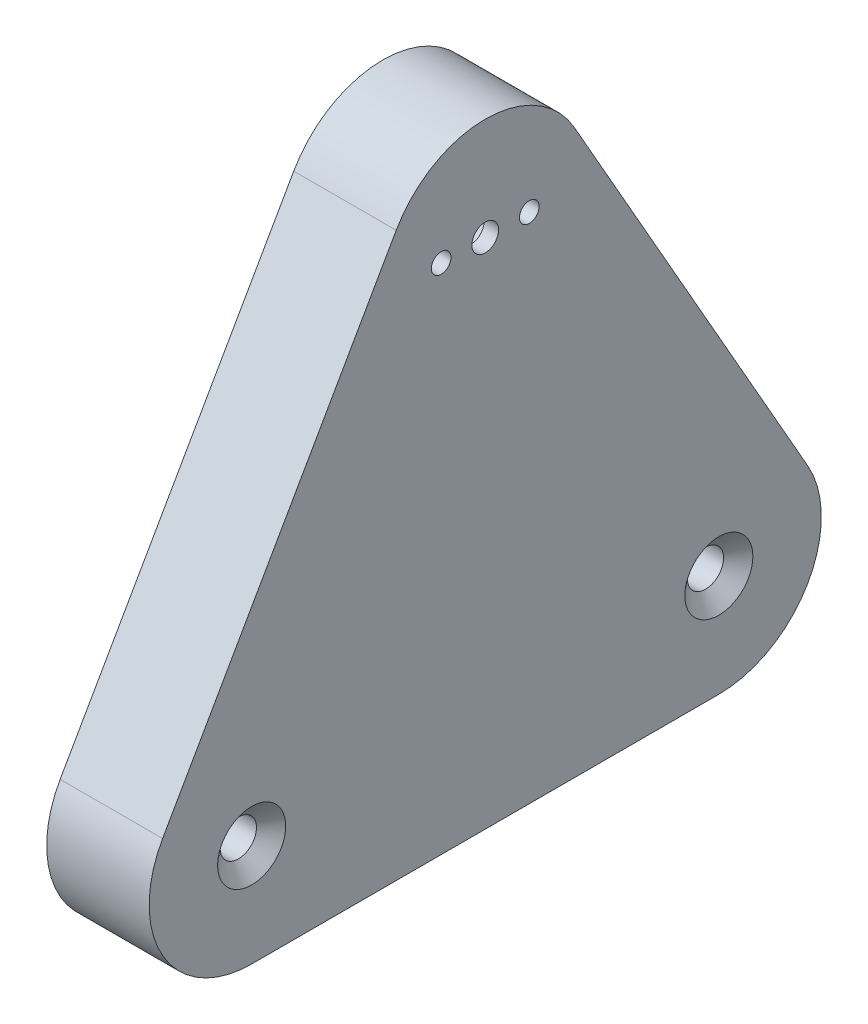
from build123d import *

# Parameters (mm, degrees)
SKETCH1_R                                         = 12.7
BOSS_EXTRUDE1_DEPTH                               = 12.7
SKETCH2_R                                         = 1.6256
CUT_EXTRUDE1_DEPTH                                = 9.525
BOSS_EXTRUDE6_START                               = -12.7
BOSS_EXTRUDE6_DEPTH                               = 12.7
SKETCH15_R                                        = 12.7
BOSS_EXTRUDE8_DEPTH                               = 12.7
SKETCH17_R                                        = 1.651
CUT_EXTRUDE4_DEPTH                                = 12.7
SKETCH18_R                                        = 3.81
CUT_EXTRUDE5_DEPTH                                = 10.9027722
SKETCH19_R                                        = 8.255
CUT_EXTRUDE6_DEPTH                                = 8.3627722
SKETCH20_R                                        = 9.525
CUT_EXTRUDE7_DEPTH                                = 5.1877722
SKETCH21_R                                        = 1.2192
CUT_EXTRUDE8_DEPTH                                = 4.3372278
SKETCH22_W                                        = 15.875
SKETCH22_H                                        = 25.4
CUT_EXTRUDE9_DEPTH                                = 33.534068682
SKETCH23_W                                        = 12.7
SKETCH23_H                                        = 25.4
BOSS_EXTRUDE9_DEPTH                               = 38.1
BOSS_EXTRUDE13_DEPTH                              = 12.7
FILLET1_R                                         = 12.7
CSK_FOR_8_FLAT_HEAD_MACHINE_SCREW_100_D           = 4.4958
CSK_FOR_8_FLAT_HEAD_MACHINE_SCREW_100_CSINK_D     = 8.4328
CSK_FOR_8_FLAT_HEAD_MACHINE_SCREW_100_CSINK_ANGLE = 100


with BuildPart() as part:
    # Sketch1 → Boss-Extrude1 (new body)
    with BuildSketch(Plane(origin=(0, 0, 0), x_dir=(1, 0, 0), z_dir=(0, 1, 0))):
        with Locations(Location((0, 0, 0), (0, 0, 270))):
            Circle(SKETCH1_R)
    extrude(amount=BOSS_EXTRUDE1_DEPTH)

    # Sketch2 → Cut-Extrude1 (cut)
    with BuildSketch(Plane.XZ):
        with Locations(Location((0, 0, 0), (0, 0, 270))):
            Circle(SKETCH2_R)
    extrude(amount=-CUT_EXTRUDE1_DEPTH, mode=Mode.SUBTRACT)

    # Sketch14 → Boss-Extrude6 (add)
    with BuildSketch(Plane(origin=(0, 12.7, 0), x_dir=(1, 0, 0), z_dir=(0, 1, 0)).offset(BOSS_EXTRUDE6_START)):
        with BuildLine():
            Line((15.875, 12.7), (0, 12.7))
            ThreePointArc((0, 12.7), (8.980256121, 8.980256121), (12.7, 0))
            ThreePointArc((12.7, 0), (8.980256121, -8.980256121), (0, -12.7))
            Line((0, -12.7), (15.875, -12.7))
            Line((15.875, -12.7), (15.875, 12.7))
        make_face()
    extrude(amount=BOSS_EXTRUDE6_DEPTH)

    # Sketch15 → Boss-Extrude8 (add)
    with BuildSketch(Plane(origin=(15.875, 0, 0), x_dir=(0, 0, -1), z_dir=(1, 0, 0))):
        with Locations((0, 25.4)):
            Circle(SKETCH15_R)
        with BuildLine():
            ThreePointArc((0, 12.7), (-8.980256121, 16.419743879), (-12.7, 25.4))
            Line((-12.7, 25.4), (-12.7, 12.7))
            Line((-12.7, 12.7), (0, 12.7))
        make_face()
        with BuildLine():
            Line((12.7, 12.7), (12.7, 25.4))
            ThreePointArc((12.7, 25.4), (8.980256121, 16.419743879), (0, 12.7))
            Line((0, 12.7), (12.7, 12.7))
        make_face()
    extrude(amount=-BOSS_EXTRUDE8_DEPTH)

    # Sketch17 → Cut-Extrude4 (cut)
    with BuildSketch(Plane.ZY.offset(-3.175)):
        with Locations((0, 25.4)):
            Circle(SKETCH17_R)
    extrude(amount=-CUT_EXTRUDE4_DEPTH, mode=Mode.SUBTRACT)

    # Sketch18 → Cut-Extrude5 (cut)
    with BuildSketch(Plane.ZY.offset(-3.175)):
        with Locations((0, 25.4)):
            Circle(SKETCH18_R)
    extrude(amount=-CUT_EXTRUDE5_DEPTH, mode=Mode.SUBTRACT)

    # Sketch19 → Cut-Extrude6 (cut)
    with BuildSketch(Plane.ZY.offset(-3.175)):
        with Locations((0, 25.4)):
            Circle(SKETCH19_R)
    extrude(amount=-CUT_EXTRUDE6_DEPTH, mode=Mode.SUBTRACT)

    # Sketch20 → Cut-Extrude7 (cut)
    with BuildSketch(Plane.ZY.offset(-3.175)):
        with Locations((0, 25.4)):
            Circle(SKETCH20_R)
    extrude(amount=-CUT_EXTRUDE7_DEPTH, mode=Mode.SUBTRACT)

    # Sketch21 → Cut-Extrude8 (cut)
    with BuildSketch(Plane.ZY.offset(-11.5377722)):
        with Locations((5.4599967, 25.4)):
            Circle(SKETCH21_R)
        with Locations((-5.4599967, 25.4)):
            Circle(SKETCH21_R)
    extrude(amount=-CUT_EXTRUDE8_DEPTH, mode=Mode.SUBTRACT)

    # Sketch22 → Cut-Extrude9 (cut, through all)
    with BuildSketch(Plane(origin=(0, 12.7, 0), x_dir=(1, 0, 0), z_dir=(0, 1, 0))):
        with Locations((-4.7625, 0)):
            Rectangle(SKETCH22_W, SKETCH22_H)
    extrude(amount=-CUT_EXTRUDE9_DEPTH, mode=Mode.SUBTRACT)

    # Sketch23 → Boss-Extrude9 (add)
    with BuildSketch(Plane.XZ):
        with Locations((9.525, 0)):
            Rectangle(SKETCH23_W, SKETCH23_H)
    extrude(amount=BOSS_EXTRUDE9_DEPTH)

    # Sketch28 → Boss-Extrude13 (add)
    with BuildSketch(Plane(origin=(15.875, 0, 0), x_dir=(0, 0, -1), z_dir=(1, 0, 0))):
        with BuildLine():
            ThreePointArc((-12.7, 25.4), (-12.276533056, 28.652189435), (-11.034372264, 31.687497812))
            Line((-11.034372264, 31.687497812), (-50.8, -38.1))
            Line((-50.8, -38.1), (-12.7, -38.1))
            Line((-12.7, -38.1), (-12.7, 25.4))
        make_face()
        with BuildLine():
            Line((50.8, -38.1), (11.034372264, 31.687497812))
            ThreePointArc((11.034372264, 31.687497812), (12.276533056, 28.652189435), (12.7, 25.4))
            Line((12.7, 25.4), (12.7, -38.1))
            Line((12.7, -38.1), (50.8, -38.1))
        make_face()
    extrude(amount=-BOSS_EXTRUDE13_DEPTH)

    # Fillet1
    fillet1_edges = [part.edges().sort_by_distance(p)[0] for p in [
        (9.525, -38.1, 50.8),
        (9.525, -38.1, -50.8),
    ]]
    fillet(fillet1_edges, radius=FILLET1_R)

    # CSK for #8 Flat Head Machine Screw (100)1 (through all)
    with Locations(Plane(origin=(15.875, 0, 0), x_dir=(0, 0, -1), z_dir=(1, 0, 0))):
        with Locations((28.946357905, -25.4), (-28.946357905, -25.4)):
            CounterSinkHole(CSK_FOR_8_FLAT_HEAD_MACHINE_SCREW_100_D / 2, CSK_FOR_8_FLAT_HEAD_MACHINE_SCREW_100_CSINK_D / 2, counter_sink_angle=CSK_FOR_8_FLAT_HEAD_MACHINE_SCREW_100_CSINK_ANGLE)


solid = part.part
